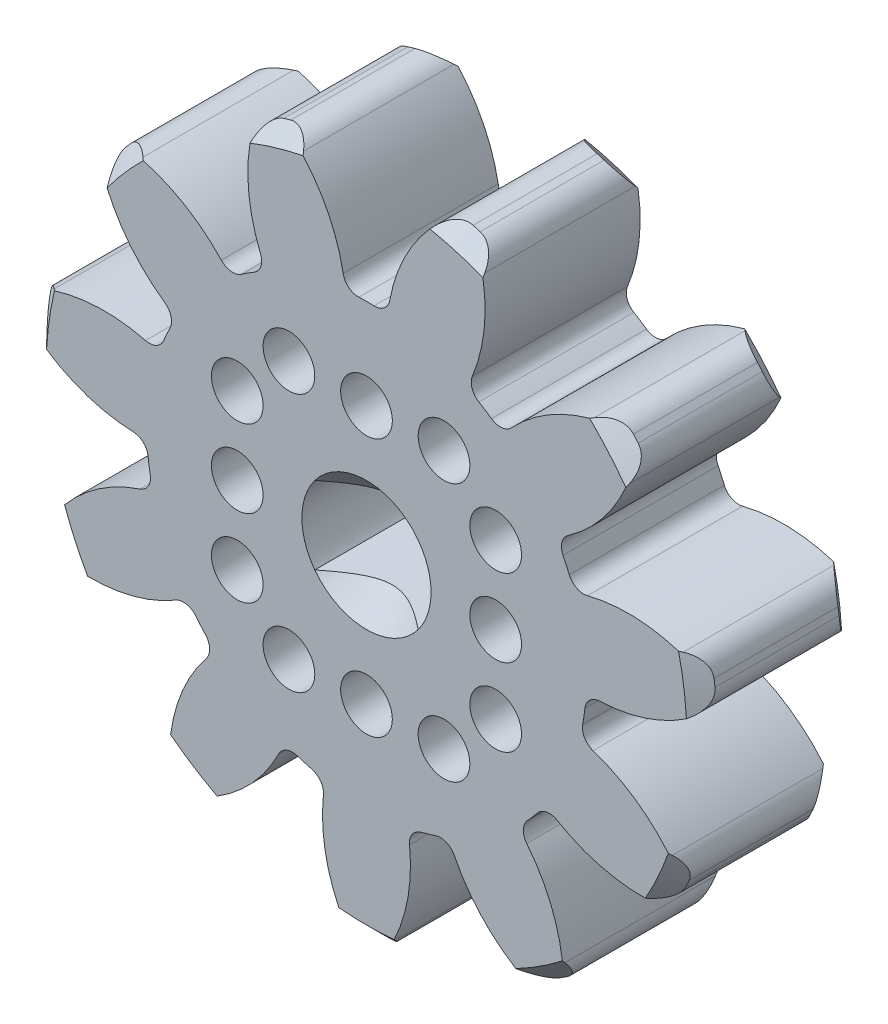
from build123d import *

# Parameters (mm, degrees)
SKETCH1_R                = 13
BOSS_EXTRUDE1_DEPTH      = 6
CUT_EXTRUDE1_DEPTH       = 20.339079606
FILLET1_R                = 0.6
CHAMFER1_SIZE            = 0.6
CIRPATTERN1_COUNT        = 11
FILLET1_OF_CIRPATTERN1_R = 0.6
SKETCH8_R                = 1
CUT_EXTRUDE4_DEPTH       = 20.306209234
CIRPATTERN2_COUNT        = 4
FILLET2_R                = 1
CUT_EXTRUDE5_DEPTH       = 20.269130833


with BuildPart() as part:
    # Sketch1 → Boss-Extrude1 (new body)
    with BuildSketch(Plane.XY):
        Circle(SKETCH1_R)
    extrude(amount=BOSS_EXTRUDE1_DEPTH)

    # Sketch2 → Cut-Extrude1 (cut, through all)
    with BuildSketch(Plane.XY):
        with BuildLine():
            ThreePointArc((-2.958726738, 12.658828385), (-1.498482345, 10.759592811), (-0.828243933, 8.459551524))
            ThreePointArc((-0.828243933, 8.459551524), (0, 8.5), (0.828243933, 8.459551524))
            ThreePointArc((0.828243933, 8.459551524), (1.498482345, 10.759592811), (2.958726738, 12.658828385))
            ThreePointArc((2.958726738, 12.658828385), (0, 13), (-2.958726738, 12.658828385))
        make_face()
    cut_extrude1 = extrude(amount=CUT_EXTRUDE1_DEPTH, mode=Mode.SUBTRACT)

    # Fillet1
    fillet1_edges = [part.edges().sort_by_distance(p)[0] for p in [
        (-0.828243933, 8.459551524, 3),
        (0.828243933, 8.459551524, 3),
    ]]
    fillet(fillet1_edges, radius=FILLET1_R)

    # Chamfer1
    chamfer1_edges = [part.edges().sort_by_distance(p)[0] for p in [
        (0, -13, 0),
        (0, -13, 6),
    ]]
    chamfer(chamfer1_edges, length=CHAMFER1_SIZE)

    # CirPattern1: Cut-Extrude1 ×11 about axis
    cirpattern1_axis = Axis((0, 0, 6), (0, 0, -1))
    for i in range(1, CIRPATTERN1_COUNT):
        add(cut_extrude1.rotate(cirpattern1_axis, i * 360 / CIRPATTERN1_COUNT), mode=Mode.SUBTRACT)

    # Fillet1 of CirPattern1
    fillet1_of_cirpattern1_edges = [part.edges().sort_by_distance(p)[0] for p in [
        (3.876815717, 7.564410083, 3),
        (5.270341986, 6.668845129, 3),
        (7.351013769, 4.267621888, 3),
        (8.039143697, 2.760827525, 3),
        (8.491316889, -0.384106103, 3),
        (8.255574086, -2.023733311, 3),
        (6.935686893, -4.91388312, 3),
        (5.850918034, -6.16577312, 3),
        (3.178025315, -7.883536966, 3),
        (1.588636847, -8.350223528, 3),
        (-1.588636847, -8.350223528, 3),
        (-3.178025315, -7.883536966, 3),
        (-5.850918034, -6.16577312, 3),
        (-6.935686893, -4.91388312, 3),
        (-8.255574086, -2.023733311, 3),
        (-8.491316889, -0.384106103, 3),
        (-8.039143697, 2.760827525, 3),
        (-7.351013769, 4.267621888, 3),
        (-5.270341986, 6.668845129, 3),
        (-3.876815717, 7.564410083, 3),
    ]]
    fillet(fillet1_of_cirpattern1_edges, radius=FILLET1_OF_CIRPATTERN1_R)

    # Sketch5 → Screw_cut (revolve, cut)
    with BuildSketch(Plane(origin=(0, 0, 0), x_dir=(0, 0, -1), z_dir=(1, 0, 0))):
        Polygon((-6, 2.5), (-6, 0), (0, 0), (0, 1.5), (-5, 1.5), align=None)
    revolve(axis=Axis((0, 0, 6), (0, 0, -1)), mode=Mode.SUBTRACT)

    # Sketch8 → Cut-Extrude4 (cut, through all)
    with BuildSketch(Plane.XY):
        with Locations((0, -5)):
            Circle(SKETCH8_R)
        with Locations((3, -5)):
            Circle(SKETCH8_R)
        with Locations((-3, -5)):
            Circle(SKETCH8_R)
    cut_extrude4 = extrude(amount=CUT_EXTRUDE4_DEPTH, mode=Mode.SUBTRACT)

    # CirPattern2: Cut-Extrude4 ×4 about axis
    cirpattern2_axis = Axis((0, 0, 6), (0, 0, -1))
    for i in range(1, CIRPATTERN2_COUNT):
        add(cut_extrude4.rotate(cirpattern2_axis, i * 360 / CIRPATTERN2_COUNT), mode=Mode.SUBTRACT)

    # Fillet2
    fillet2_edges = [part.edges().sort_by_distance(p)[0] for p in [
        (-2.958726738, 12.658828385, 3),
        (2.958726738, 12.658828385, 3),
        (4.354840005, 12.248892543, 3),
        (9.332918647, 9.049675658, 3),
        (10.285775817, 7.950019865, 3),
        (12.743974829, 2.567314852, 3),
        (12.951050482, 1.127072052, 3),
        (12.108909048, -4.73015028, 3),
        (11.504458127, -6.053713174, 3),
        (7.629350201, -10.52582612, 3),
        (6.405281604, -11.312487241, 3),
        (0.727526572, -12.979626539, 3),
        (-0.727526572, -12.979626539, 3),
        (-6.405281604, -11.312487241, 3),
        (-7.629350201, -10.52582612, 3),
        (-11.504458127, -6.053713174, 3),
        (-12.108909048, -4.73015028, 3),
        (-12.951050482, 1.127072052, 3),
        (-12.743974829, 2.567314852, 3),
        (-10.285775817, 7.950019865, 3),
        (-9.332918647, 9.049675658, 3),
        (-4.354840005, 12.248892543, 3),
    ]]
    fillet(fillet2_edges, radius=FILLET2_R)

    # Sketch9 → Cut-Extrude5 (cut, through all)
    with BuildSketch(Plane.XY):
        with BuildLine():
            ThreePointArc((-2, 1.5), (-2.5, 0), (-2, -1.5))
            Line((-2, -1.5), (2, -1.5))
            ThreePointArc((2, -1.5), (2.5, 0), (2, 1.5))
            Line((2, 1.5), (-2, 1.5))
        make_face()
    extrude(amount=CUT_EXTRUDE5_DEPTH, mode=Mode.SUBTRACT)


solid = part.part
